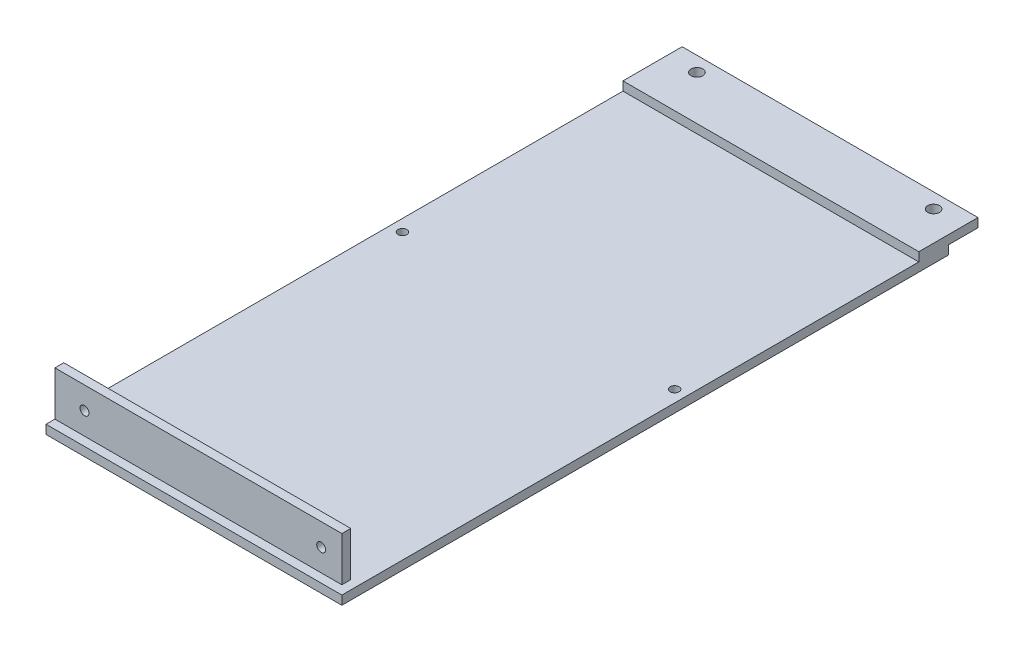
from build123d import *

# Parameters (mm, degrees)
SKETCH1_W           = 100
SKETCH1_H           = 205
BOSS_EXTRUDE1_DEPTH = 3
SKETCH2_W           = 100
SKETCH2_H           = 20
BOSS_EXTRUDE2_DEPTH = 3
CUT_EXTRUDE1_REACH  = 125.257
SKETCH3_R           = 2
LPATTERN1_COUNT     = 2
LPATTERN1_PITCH     = 80
SKETCH4_W           = 100
SKETCH4_H           = 3
BOSS_EXTRUDE3_DEPTH = 15
CUT_EXTRUDE2_REACH  = 220.559
SKETCH5_R           = 1.5
LPATTERN2_COUNT     = 2
LPATTERN2_PITCH     = 80
SKETCH7_W           = 3
SKETCH7_H           = 15
CUT_EXTRUDE3_DEPTH  = 3
CUT_EXTRUDE4_REACH  = 126.021
SKETCH6_R           = 1.5


with BuildPart() as part:
    # Sketch1 → Boss-Extrude1 (new body)
    with BuildSketch(Plane(origin=(0, 0, 0), x_dir=(1, 0, 0), z_dir=(0, 1, 0))):
        Rectangle(SKETCH1_W, SKETCH1_H)
    extrude(amount=BOSS_EXTRUDE1_DEPTH)

    # Sketch2 → Boss-Extrude2 (add)
    with BuildSketch(Plane(origin=(0, 3, 0), x_dir=(1, 0, 0), z_dir=(0, 1, 0))):
        with Locations((0, 102.5)):
            Rectangle(SKETCH2_W, SKETCH2_H)
    extrude(amount=BOSS_EXTRUDE2_DEPTH)

    # Sketch3 → Cut-Extrude1 (cut, up to next)
    with BuildSketch(Plane(origin=(0, 6, 0), x_dir=(1, 0, 0), z_dir=(0, 1, 0)), mode=Mode.PRIVATE) as cut_extrude1_sk1:
        with Locations(Location((-40, 107.5, 0), (0, 0, 270))):
            Circle(SKETCH3_R)
    cut_extrude1_tool1 = extrude(cut_extrude1_sk1.sketch, amount=-CUT_EXTRUDE1_REACH, mode=Mode.PRIVATE) & part.part
    cut_extrude1 = cut_extrude1_tool1.solids().sort_by_distance((-40, 6, -107.5))[0]
    add(cut_extrude1, mode=Mode.SUBTRACT)

    # LPattern1: Cut-Extrude1 ×2
    with Locations(*[(i * LPATTERN1_PITCH, 0, 0) for i in range(1, LPATTERN1_COUNT)]):
        add(cut_extrude1, mode=Mode.SUBTRACT)

    # Sketch4 → Boss-Extrude3 (add)
    with BuildSketch(Plane(origin=(0, 3, 0), x_dir=(1, 0, 0), z_dir=(0, 1, 0))):
        with Locations((0, -98)):
            Rectangle(SKETCH4_W, SKETCH4_H)
    extrude(amount=BOSS_EXTRUDE3_DEPTH)

    # Sketch5 → Cut-Extrude2 (cut, up to next)
    with BuildSketch(Plane.XY.offset(99.5), mode=Mode.PRIVATE) as cut_extrude2_sk1:
        with Locations((-40, 10.5)):
            Circle(SKETCH5_R)
    cut_extrude2_tool1 = extrude(cut_extrude2_sk1.sketch, amount=-CUT_EXTRUDE2_REACH, mode=Mode.PRIVATE) & part.part
    cut_extrude2 = cut_extrude2_tool1.solids().sort_by_distance((-40, 10.5, 99.5))[0]
    add(cut_extrude2, mode=Mode.SUBTRACT)

    # LPattern2: Cut-Extrude2 ×2
    with Locations(*[(i * LPATTERN2_PITCH, 0, 0) for i in range(1, LPATTERN2_COUNT)]):
        add(cut_extrude2, mode=Mode.SUBTRACT)

    # Sketch7 → Cut-Extrude3 (cut)
    with BuildSketch(Plane(origin=(50, 0, 0), x_dir=(0, 0, -1), z_dir=(1, 0, 0))):
        with Locations((-98, 10.5)):
            Rectangle(SKETCH7_W, SKETCH7_H)
    extrude(amount=-CUT_EXTRUDE3_DEPTH, mode=Mode.SUBTRACT)

    # Sketch6 → Cut-Extrude4 (cut, up to next)
    with BuildSketch(Plane(origin=(0, 3, 0), x_dir=(1, 0, 0), z_dir=(0, 1, 0)), mode=Mode.PRIVATE) as cut_extrude4_sk1:
        with Locations(Location((-46, 13.97, 0), (0, 0, 270))):
            Circle(SKETCH6_R)
    cut_extrude4_tool1 = extrude(cut_extrude4_sk1.sketch, amount=-CUT_EXTRUDE4_REACH, mode=Mode.PRIVATE) & part.part
    # Sketch6 → Cut-Extrude4 (cut, up to next)
    with BuildSketch(Plane(origin=(0, 3, 0), x_dir=(1, 0, 0), z_dir=(0, 1, 0)), mode=Mode.PRIVATE) as cut_extrude4_sk2:
        with Locations(Location((46, 13.97, 0), (0, 0, 270))):
            Circle(SKETCH6_R)
    cut_extrude4_tool2 = extrude(cut_extrude4_sk2.sketch, amount=-CUT_EXTRUDE4_REACH, mode=Mode.PRIVATE) & part.part
    add(cut_extrude4_tool1.solids().sort_by_distance((-46, 3, -13.97))[0], mode=Mode.SUBTRACT)
    add(cut_extrude4_tool2.solids().sort_by_distance((46, 3, -13.97))[0], mode=Mode.SUBTRACT)


solid = part.part
